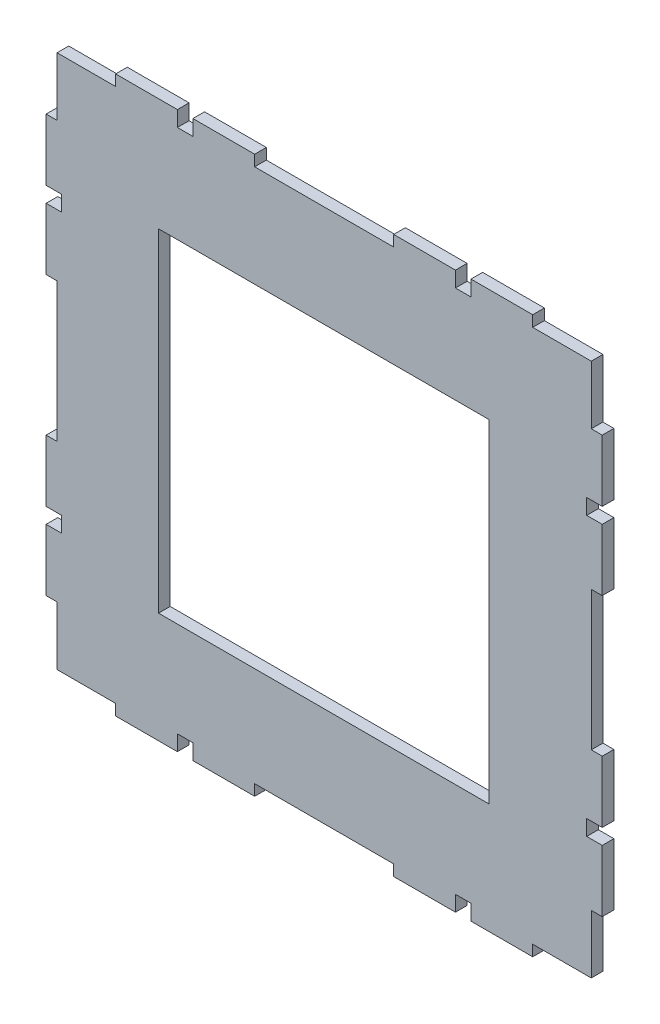
from build123d import *

# Parameters (mm, degrees)
SKETCH1_W           = 89.973098965
SKETCH1_H           = 90.646237782
BOSS_EXTRUDE1_DEPTH = 3.175


with BuildPart() as part:
    # Sketch1 → Boss-Extrude1 (new body)
    with BuildSketch(Plane.XY):
        Polygon((311.775650515, 151.416855126), (311.775650515, 135.470394989), (308.79500376, 135.470394989), (308.79500376, 118.65457955), (313.017586662, 118.65457955), (313.017586662, 116.543288099), (313.017586662, 114.431996648), (308.79500376, 114.431996648), (308.79500376, 97.616181208), (311.775650515, 97.616181208), (311.775650515, 59.761967427), (308.79500376, 59.761967427), (308.79500376, 42.946151987), (313.017586662, 42.946151987), (313.017586662, 40.834860536), (313.017586662, 38.723569085), (308.79500376, 38.723569085), (308.79500376, 21.907753645), (311.775650515, 21.907753645), (311.775650515, 5.961293509), (327.722110651, 5.961293509), (327.722110651, 2.980646754), (344.53792609, 2.980646754), (344.53792609, 7.203229657), (346.649217542, 7.203229657), (348.760508993, 7.203229657), (348.760508993, 2.980646754), (365.576324432, 2.980646754), (365.576324432, 5.961293509), (403.430538214, 5.961293509), (403.430538214, 2.980646754), (420.246353653, 2.980646754), (420.246353653, 7.203229657), (422.357645104, 7.203229657), (424.468936555, 7.203229657), (424.468936555, 2.980646754), (441.284751995, 2.980646754), (441.284751995, 5.961293509), (457.231212131, 5.961293509), (457.231212131, 21.907753645), (460.211858886, 21.907753645), (460.211858886, 38.723569085), (455.989275984, 38.723569085), (455.989275984, 40.834860536), (455.989275984, 42.946151987), (460.211858886, 42.946151987), (460.211858886, 59.761967427), (457.231212131, 59.761967427), (457.231212131, 97.616181208), (460.211858886, 97.616181208), (460.211858886, 114.431996648), (455.989275984, 114.431996648), (455.989275984, 116.543288099), (455.989275984, 118.65457955), (460.211858886, 118.65457955), (460.211858886, 135.470394989), (457.231212131, 135.470394989), (457.231212131, 151.416855126), (441.284751995, 151.416855126), (441.284751995, 154.39750188), (424.468936555, 154.39750188), (424.468936555, 150.174918978), (422.357645104, 150.174918978), (420.246353653, 150.174918978), (420.246353653, 154.39750188), (403.430538214, 154.39750188), (403.430538214, 151.416855126), (365.576324432, 151.416855126), (365.576324432, 154.39750188), (348.760508993, 154.39750188), (348.760508993, 150.174918978), (346.649217542, 150.174918978), (344.53792609, 150.174918978), (344.53792609, 154.39750188), (327.722110651, 154.39750188), (327.722110651, 151.416855126), align=None)
        with Locations((384.387424227, 78.399039157)):
            Rectangle(SKETCH1_W, SKETCH1_H, mode=Mode.SUBTRACT)
    extrude(amount=BOSS_EXTRUDE1_DEPTH)


solid = part.part
